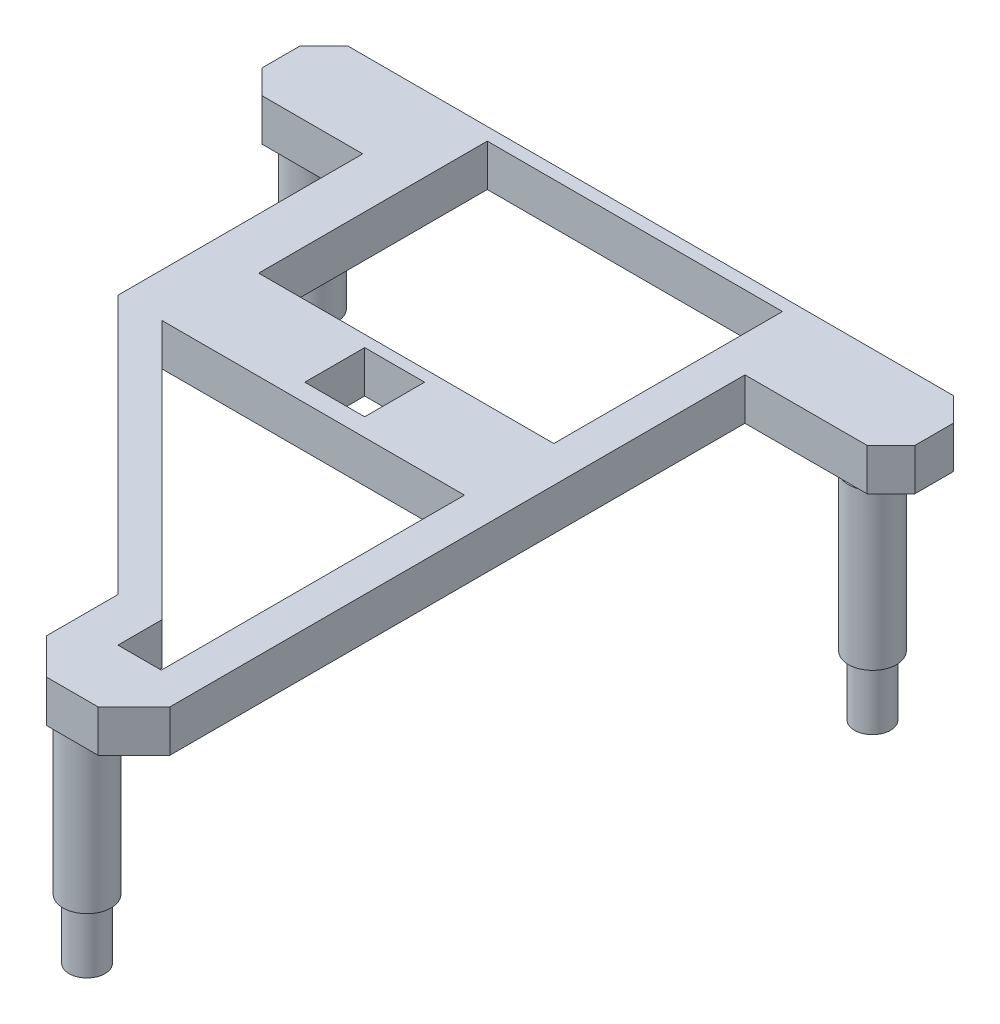
from build123d import *

# Parameters (mm, degrees)
SKETCH4_W           = 24.633837396
SKETCH4_H           = 19.082768461
SKETCH4_W_2         = 5
SKETCH4_H_2         = 5
MAINBRACKET_DEPTH   = 3.5
SKETCH3_R           = 2
BOSS_EXTRUDE2_DEPTH = 13
SKETCH6_R           = 1.5
BOSS_EXTRUDE3_DEPTH = 5


with BuildPart() as part:
    # Sketch4 → MainBracket (new body)
    with BuildSketch(Plane(origin=(0, 0, 0), x_dir=(1, 0, 0), z_dir=(0, 1, 0))):
        Polygon((-25.001052975, 23.597895529), (25.52718448, 23.597895529), (27.52718448, 21.597895529), (27.52718448, 18.397895529), (25.52718448, 16.397895529), (15.338231538, 16.397895529), (15.338231538, -31.590979949), (12.338231538, -34.590979949), (8.051942307, -34.590979949), (5.051942307, -31.590979949), (5.051942307, -25.634971446), (-16.583029139, -4), (-16.583029139, 16.421906692), (-25.001052975, 16.421906692), (-27.001052975, 18.421906692), (-27.001052975, 21.597895529), align=None)
        with Locations((0.008956485, 13.000441896)):
            Rectangle(SKETCH4_W, SKETCH4_H, mode=Mode.SUBTRACT)
        Polygon((-12.927683275, -4), (8.707288171, -25.634971446), (8.707288171, -29.300035445), (12.325875183, -29.300035445), (12.325875183, -4), align=None, mode=Mode.SUBTRACT)
        Rectangle(SKETCH4_W_2, SKETCH4_H_2, mode=Mode.SUBTRACT)
    extrude(amount=MAINBRACKET_DEPTH)

    # Sketch3 → Boss-Extrude2 (add)
    with BuildSketch(Plane(origin=(0, 0, 0), x_dir=(1, 0, 0), z_dir=(0, 1, 0))):
        with Locations((-24.011269627, 19.663273311)):
            Circle(SKETCH3_R)
        with Locations((24.107482847, 18.27469294)):
            Circle(SKETCH3_R)
        with Locations((8.917908931, -32.088026328)):
            Circle(SKETCH3_R)
    extrude(amount=-BOSS_EXTRUDE2_DEPTH)

    # Sketch6 → Boss-Extrude3 (add)
    with BuildSketch(Plane.XZ.offset(13)):
        with Locations((-24.011269627, -19.663273311)):
            Circle(SKETCH6_R)
        with Locations((8.917908931, 32.088026328)):
            Circle(SKETCH6_R)
        with Locations((24.107482847, -18.27469294)):
            Circle(SKETCH6_R)
    extrude(amount=BOSS_EXTRUDE3_DEPTH)


solid = part.part
